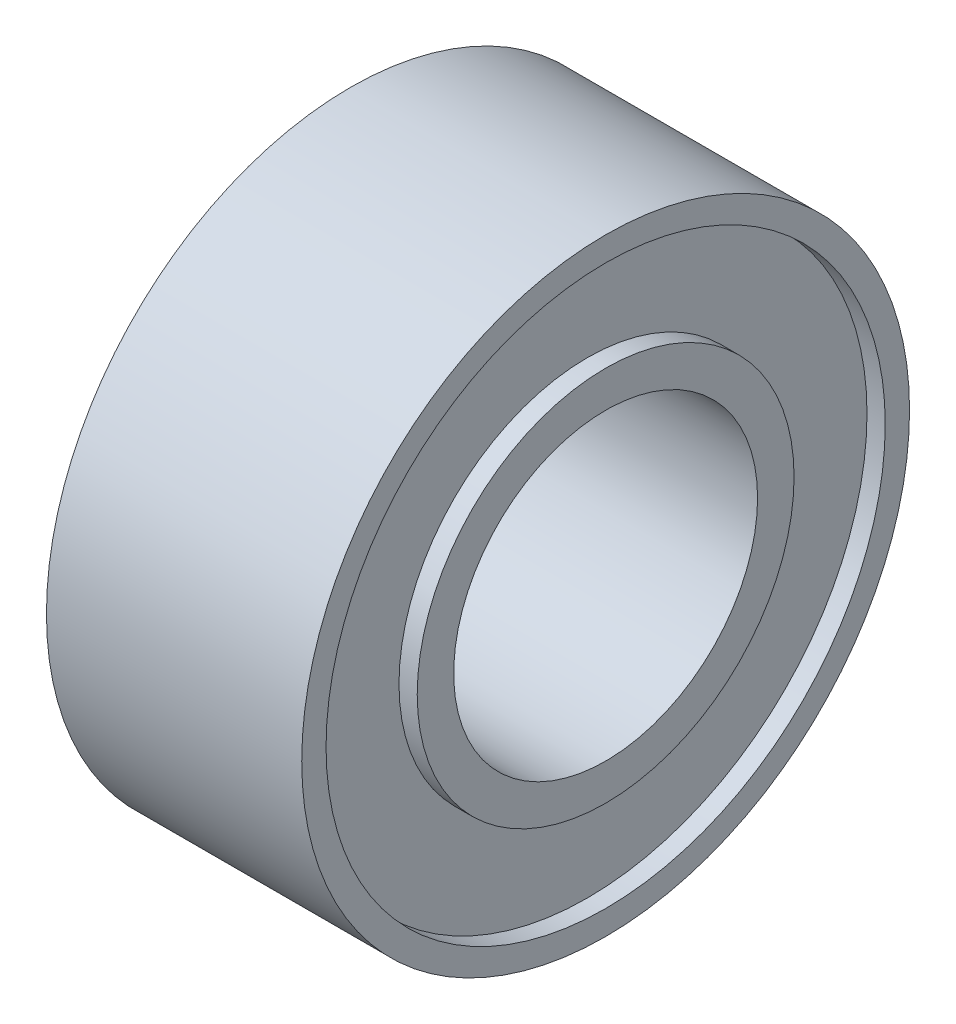
from build123d import *


with BuildPart() as part:
    # Sketch1 → Revolve1 (revolve)
    with BuildSketch(Plane.XY, mode=Mode.PRIVATE) as revolve1_sk:
        Polygon((2.1, 2.5), (-2.1, 2.5), (-2.1, 3.1), (-1.8, 3.1), (-1.8, 4.6), (-2.1, 4.6), (-2.1, 5), (2.1, 5), (2.1, 4.6), (1.8, 4.6), (1.8, 3.1), (2.1, 3.1), align=None)
    revolve(revolve1_sk.sketch.rotate(Axis((0, 0, 0), (-1, 0, 0)), 90), axis=Axis((0, 0, 0), (-1, 0, 0)))


solid = part.part
